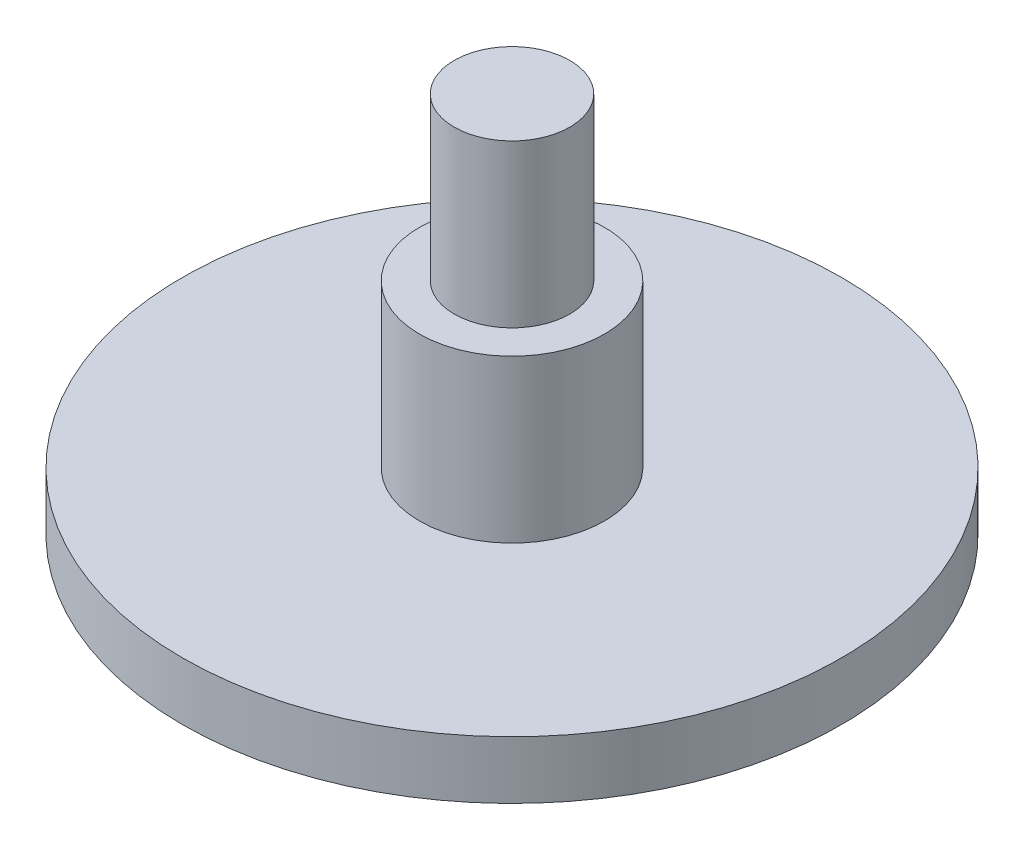
from build123d import *

# Parameters (mm, degrees)
SKETCH1_R           = 28.5
BOSS_EXTRUDE1_DEPTH = 5
SKETCH2_R           = 8
BOSS_EXTRUDE2_DEPTH = 14
SKETCH3_R           = 5
BOSS_EXTRUDE3_DEPTH = 14


with BuildPart() as part:
    # Sketch1 → Boss-Extrude1 (new body)
    with BuildSketch(Plane(origin=(0, 0, 0), x_dir=(1, 0, 0), z_dir=(0, 1, 0))):
        with Locations(Location((0, 0, 0), (0, 0, 270))):
            Circle(SKETCH1_R)
    extrude(amount=BOSS_EXTRUDE1_DEPTH)

    # Sketch2 → Boss-Extrude2 (add)
    with BuildSketch(Plane(origin=(0, 5, 0), x_dir=(1, 0, 0), z_dir=(0, 1, 0))):
        with Locations(Location((0, 0, 0), (0, 0, 270))):
            Circle(SKETCH2_R)
    extrude(amount=BOSS_EXTRUDE2_DEPTH)

    # Sketch3 → Boss-Extrude3 (add)
    with BuildSketch(Plane(origin=(0, 19, 0), x_dir=(1, 0, 0), z_dir=(0, 1, 0))):
        with Locations(Location((0, 0, 0), (0, 0, 270))):
            Circle(SKETCH3_R)
    extrude(amount=BOSS_EXTRUDE3_DEPTH)


solid = part.part
